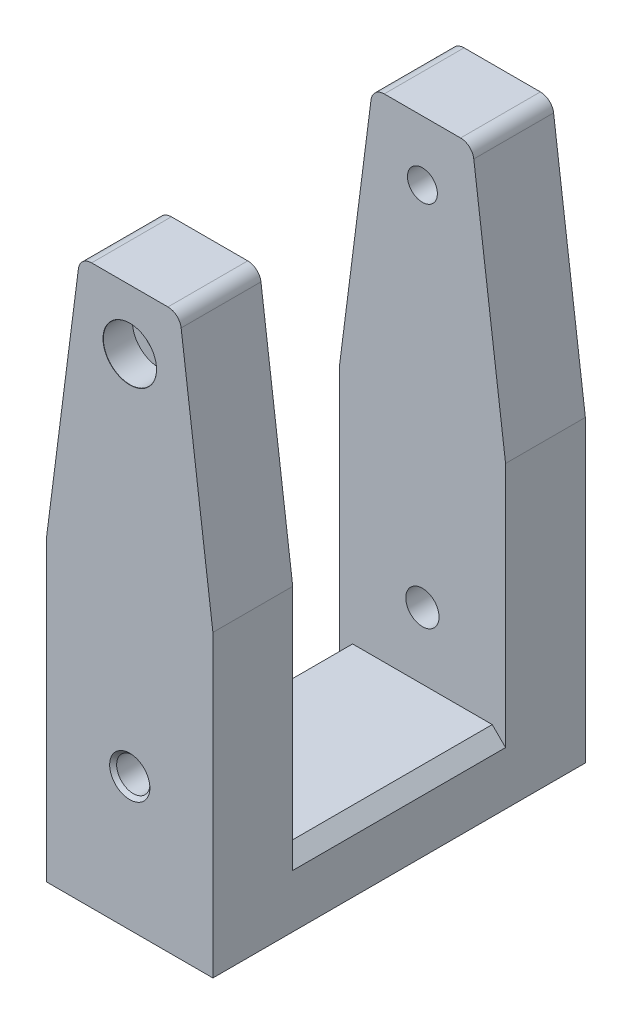
from build123d import *

# Parameters (mm, degrees)
BOSS_EXTRUDE1_DEPTH = 28
SKETCH2_W           = 32
SKETCH2_H           = 74
CUT_EXTRUDE1_DEPTH  = 93.005434622
CHAMFER1_SIZE       = 2
FILLET1_R           = 2


with BuildPart() as part:
    # Sketch1 → Boss-Extrude1 (new, symmetric)
    with BuildSketch(Plane.XY):
        Polygon((12.5, 0), (-12.5, 0), (-12.5, 45), (-7.5, 84), (7.5, 84), (12.5, 45), align=None)
    extrude(amount=BOSS_EXTRUDE1_DEPTH, both=True)

    # Sketch2 → Cut-Extrude1 (cut, through all)
    with BuildSketch(Plane(origin=(12.5, 0, 0), x_dir=(0, 0, -1), z_dir=(1, 0, 0))):
        with Locations((0, 47)):
            Rectangle(SKETCH2_W, SKETCH2_H)
    extrude(amount=-CUT_EXTRUDE1_DEPTH, mode=Mode.SUBTRACT)

    # Sketch7 → CBORE for M4 Hex Socket Head Cap Screw1 (revolve, cut)
    with BuildSketch(Plane(origin=(0, 75, 28), x_dir=(0, -1, 0), z_dir=(1, 0, 0))):
        Polygon((0, 0), (0, 21.351936393), (2.25, 20), (2.25, 4.4), (4, 4.4), (4, 0.025), (4.025, 0), align=None)
    cbore_for_m4_hex_socket_head_cap_screw1 = revolve(axis=Axis((0, 75, 34.35), (0, 0, -1)), mode=Mode.SUBTRACT)

    # Mirror1: CBORE for M4 Hex Socket Head Cap Screw1 across plane
    add(cbore_for_m4_hex_socket_head_cap_screw1.mirror(Plane.XY), mode=Mode.SUBTRACT)

    # Sketch9 → M6 Tapped Hole1 (revolve, cut)
    with BuildSketch(Plane(origin=(0, 20, 28), x_dir=(0, -1, 0), z_dir=(1, 0, 0))):
        Polygon((0, 0), (0, 28.502151548), (2.5, 27), (2.5, 0.525), (3.025, 0), align=None)
    m6_tapped_hole1 = revolve(axis=Axis((0, 20, 34.35), (0, 0, -1)), mode=Mode.SUBTRACT)

    # Chamfer1
    chamfer1_edges = [part.edges().sort_by_distance(p)[0] for p in [
        (12.5, 10, 0),
        (-12.5, 10, 0),
    ]]
    chamfer(chamfer1_edges, length=CHAMFER1_SIZE)

    # Fillet1
    fillet1_edges = [part.edges().sort_by_distance(p)[0] for p in [
        (-7.5, 84, 22),
        (7.5, 84, 22),
        (-7.5, 84, -22),
        (7.5, 84, -22),
    ]]
    fillet(fillet1_edges, radius=FILLET1_R)

    # Mirror2: M6 Tapped Hole1 across plane
    add(m6_tapped_hole1.mirror(Plane.XY), mode=Mode.SUBTRACT)


solid = part.part
